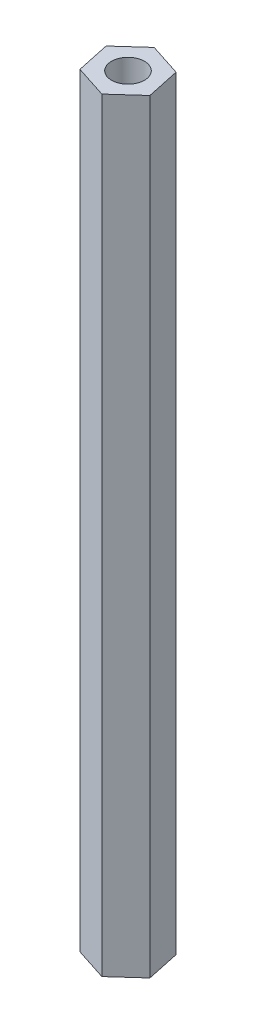
from build123d import *

# Parameters (mm, degrees)
RESSALTO_EXTRUS_O1_DEPTH                    = 73
FURO_ROSCADO_PARA_CONDU_TE_DE_M3X0_51_D     = 3.15
FURO_ROSCADO_PARA_CONDU_TE_DE_M3X0_51_DEPTH = 10
FURO_ROSCADO_PARA_CONDU_TE_DE_M3X0_51_TIP   = 0.946355475
FURO_ROSCADO_PARA_CONDU_TE_DE_M3X0_52_D     = 3.15
FURO_ROSCADO_PARA_CONDU_TE_DE_M3X0_52_DEPTH = 10
FURO_ROSCADO_PARA_CONDU_TE_DE_M3X0_52_TIP   = 0.946355475


with BuildPart() as part:
    # Esboço1 → Ressalto-extrusão1 (new body)
    with BuildSketch(Plane(origin=(0, 0, 0), x_dir=(1, 0, 0), z_dir=(0, 1, 0))):
        Polygon((3.092003015, -1.00100817), (2.412900012, 2.177249074), (-0.679103003, 3.178257244), (-3.092003015, 1.00100817), (-2.412900012, -2.177249074), (0.679103003, -3.178257244), align=None)
    extrude(amount=RESSALTO_EXTRUS_O1_DEPTH)

    # Furo roscado para conduíte de M3x0.51
    with Locations(Plane(origin=(0, 0, 0), x_dir=(-1, 0, 0), z_dir=(0, -1, 0))):
        with Locations((0, 0)):
            Hole(FURO_ROSCADO_PARA_CONDU_TE_DE_M3X0_51_D / 2, depth=FURO_ROSCADO_PARA_CONDU_TE_DE_M3X0_51_DEPTH)
            with Locations((0, 0, -(FURO_ROSCADO_PARA_CONDU_TE_DE_M3X0_51_DEPTH + FURO_ROSCADO_PARA_CONDU_TE_DE_M3X0_51_TIP / 2))):  # 118° drill point
                Cone(0, FURO_ROSCADO_PARA_CONDU_TE_DE_M3X0_51_D / 2, FURO_ROSCADO_PARA_CONDU_TE_DE_M3X0_51_TIP, mode=Mode.SUBTRACT)

    # Furo roscado para conduíte de M3x0.52
    with Locations(Plane(origin=(0, 73, 0), x_dir=(1, 0, 0), z_dir=(0, 1, 0))):
        with Locations((0, 0)):
            Hole(FURO_ROSCADO_PARA_CONDU_TE_DE_M3X0_52_D / 2, depth=FURO_ROSCADO_PARA_CONDU_TE_DE_M3X0_52_DEPTH)
            with Locations((0, 0, -(FURO_ROSCADO_PARA_CONDU_TE_DE_M3X0_52_DEPTH + FURO_ROSCADO_PARA_CONDU_TE_DE_M3X0_52_TIP / 2))):  # 118° drill point
                Cone(0, FURO_ROSCADO_PARA_CONDU_TE_DE_M3X0_52_D / 2, FURO_ROSCADO_PARA_CONDU_TE_DE_M3X0_52_TIP, mode=Mode.SUBTRACT)


solid = part.part
